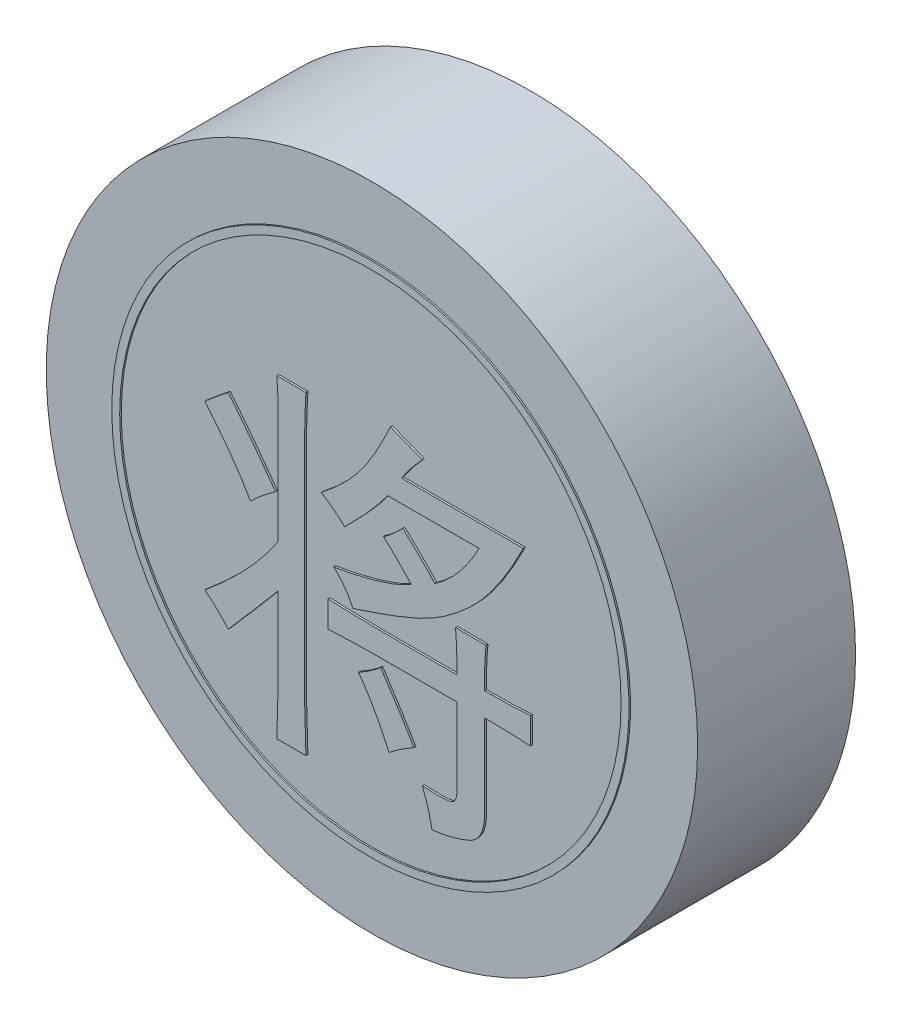
from build123d import *

# Parameters (mm, degrees)
SKETCH_1_R               = 16.5
DIAMETER33_HEIGHT8_DEPTH = 8
CHARACTER_DEPTH          = 0.1
SKETCH_3_R               = 13.1
SKETCH_3_R_2             = 12.7
INK_RING_DEPTH           = 0.08


with BuildPart() as part:
    # 草图1 → Diameter33_Height8 (new body)
    with BuildSketch(Plane.XY):
        Circle(SKETCH_1_R)
    extrude(amount=-DIAMETER33_HEIGHT8_DEPTH)

    # 草图2 → Character_将 (add)
    with BuildSketch(Plane.XY):
        with BuildLine():
            add(Edge.make_bspline(
                [(2.649122807, 5.675438596), (2.547995251, 5.560756708), (2.350386158, 5.336661664), (2.072088619, 4.999996886), (1.82216465, 4.669957417), (1.670222599, 4.449220176), (1.596491228, 4.342105263)],
                knots=[0, 0, 0, 0, 1.079161469, 2.108743928, 3.08224943, 4, 4, 4, 4], degree=3))
            Line((1.596491228, 4.342105263), (7.771929825, 4.342105263))
            add(Edge.make_bspline(
                [(7.771929825, 4.342105263), (7.667293114, 4.137951126), (7.462897396, 3.739159623), (7.14650433, 3.165780002), (6.830319772, 2.631431553), (6.509334526, 2.138740654), (6.187952882, 1.684181362), (5.866518034, 1.267837973), (5.544066977, 0.891001401), (5.114912302, 0.451463673), (4.575373631, -0.039323123), (3.911001462, -0.553369879), (3.238867264, -0.992218958), (2.540150828, -1.354562345), (1.794560835, -1.669402354), (0.986464371, -1.988789786), (0.091866991, -2.300206116), (-0.534313385, -2.500960186), (-0.859649123, -2.605263158)],
                knots=[0, 0, 0, 0, 0.956461889, 1.868337722, 2.730067817, 3.544633787, 4.319388845, 5.05060464, 5.737050918, 6.385914423, 7.610816521, 8.774810077, 9.884977967, 10.952971927, 12.051495524, 13.258260257, 14.57551281, 16, 16, 16, 16], degree=3))
            add(Edge.make_bspline(
                [(-0.859649123, -2.605263158), (-0.921076882, -2.479868395), (-1.043665257, -2.2296242), (-1.274908543, -1.88231672), (-1.537540367, -1.557773281), (-1.740146746, -1.367621007), (-1.842105263, -1.271929825)],
                knots=[0, 0, 0, 0, 1.00365356, 2.002942333, 2.995011704, 4, 4, 4, 4], degree=3))
            add(Edge.make_bspline(
                [(-1.842105263, -1.271929825), (-1.675538979, -1.246374258), (-1.334292248, -1.194018203), (-0.817047115, -1.088944947), (-0.281868941, -0.962437589), (0.26066697, -0.822709346), (0.785261702, -0.659231778), (1.270303533, -0.485149549), (1.701410748, -0.29397459), (1.963035545, -0.14834889), (2.087719298, -0.078947368)],
                knots=[0, 0, 0, 0, 0.979493574, 2.006702509, 3.067069232, 4.176257781, 5.262653342, 6.260045427, 7.170781712, 8, 8, 8, 8], degree=3))
            add(Edge.make_bspline(
                [(2.087719298, -0.078947368), (1.86881131, 0.157847942), (1.419350477, 0.644034938), (0.933453464, 1.093834703), (0.684210526, 1.324561404)],
                knots=[0, 0, 0, 0, 0.9740915, 2, 2, 2, 2], degree=3))
            add(Edge.make_bspline(
                [(0.684210526, 1.324561404), (0.710565367, 1.338712046), (0.768728724, 1.369941559), (0.8562959, 1.435673371), (0.960989273, 1.512375064), (1.077300152, 1.60862876), (1.20485704, 1.724784176), (1.346913264, 1.856517261), (1.503626832, 2.004770556), (1.610586189, 2.110979593), (1.666666667, 2.166666667)],
                knots=[0, 0, 0, 0, 0.552596433, 1.21954308, 2.020828341, 2.954454623, 4.009841916, 5.21187664, 6.538142936, 8, 8, 8, 8], degree=3))
            add(Edge.make_bspline(
                [(1.666666667, 2.166666667), (1.762088582, 2.076694304), (1.945781391, 1.903492207), (2.207761274, 1.652569932), (2.444121991, 1.419311081), (2.660802857, 1.21064161), (2.849941343, 1.018500147), (3.014552693, 0.845260055), (3.157352305, 0.694175397), (3.241984657, 0.59705955), (3.280701754, 0.552631579)],
                knots=[0, 0, 0, 0, 1.378471289, 2.653638435, 3.812716353, 4.868778462, 5.815322237, 6.646168057, 7.380657144, 8, 8, 8, 8], degree=3))
            add(Edge.make_bspline(
                [(3.280701754, 0.552631579), (3.391202618, 0.631480441), (3.613289383, 0.789952403), (3.925066626, 1.061581392), (4.227212607, 1.354774561), (4.515811142, 1.674868514), (4.790052671, 2.022264561), (5.04755707, 2.397774585), (5.300674154, 2.794713982), (5.450227675, 3.076125129), (5.526315789, 3.219298246)],
                knots=[0, 0, 0, 0, 0.924716273, 1.858512587, 2.814741213, 3.793048226, 4.793625974, 5.828834084, 6.895379252, 8, 8, 8, 8], degree=3))
            Line((5.526315789, 3.219298246), (0.894736842, 3.219298246))
            add(Edge.make_bspline(
                [(0.894736842, 3.219298246), (0.83815544, 3.13915603), (0.718899079, 2.970240651), (0.517872436, 2.712555071), (0.284245547, 2.438580125), (0.028819729, 2.1389746), (-0.257841465, 1.822404833), (-0.573265384, 1.487064304), (-0.916268812, 1.130854683), (-1.156498533, 0.888473475), (-1.280701754, 0.763157895)],
                knots=[0, 0, 0, 0, 0.716714086, 1.510614975, 2.386739176, 3.347269716, 4.387082353, 5.506647018, 6.710890262, 8, 8, 8, 8], degree=3))
            add(Edge.make_bspline(
                [(-1.280701754, 0.763157895), (-1.366268731, 0.844926758), (-1.540008164, 1.010954314), (-1.826521144, 1.242692633), (-2.138185293, 1.466482593), (-2.360232461, 1.604778386), (-2.473684211, 1.675438596)],
                knots=[0, 0, 0, 0, 0.943180642, 1.915080753, 2.934741037, 4, 4, 4, 4], degree=3))
            add(Edge.make_bspline(
                [(-2.473684211, 1.675438596), (-2.272414736, 1.836812452), (-1.882629089, 2.149334821), (-1.349168985, 2.642060255), (-0.878699224, 3.132161086), (-0.534402525, 3.552870114), (-0.285762925, 3.901948228), (-0.098629156, 4.179634678), (0.090025045, 4.479618404), (0.274039184, 4.80436189), (0.466182213, 5.147479353), (0.653863844, 5.514727625), (0.847964968, 5.901647032), (0.971732223, 6.169768333), (1.035087719, 6.307017544)],
                knots=[0, 0, 0, 0, 1.578922043, 3.057796785, 4.442105242, 5.735171578, 6.381329358, 7.06536331, 7.784990334, 8.550089925, 9.350129919, 10.192259238, 11.074631549, 12, 12, 12, 12], degree=3))
            add(Edge.make_bspline(
                [(1.035087719, 6.307017544), (1.125250521, 6.273390025), (1.299686952, 6.208331438), (1.550472821, 6.111824655), (1.782523727, 6.024473215), (1.993085056, 5.940034543), (2.184825827, 5.865357958), (2.357475637, 5.79753416), (2.510353639, 5.736054569), (2.605023832, 5.694701537), (2.649122807, 5.675438596)],
                knots=[0, 0, 0, 0, 1.33238246, 2.57773759, 3.720603536, 4.765328367, 5.71873806, 6.569669246, 7.333727776, 8, 8, 8, 8], degree=3))
        make_face()
        with BuildLine():
            Line((4.403508772, -2.885964912), (4.403508772, -2.254385965))
            add(Edge.make_bspline(
                [(4.403508772, -2.254385965), (4.40224465, -2.15474185), (4.399572645, -1.9441217), (4.385382124, -1.61054798), (4.365582936, -1.242167427), (4.344397253, -0.985117725), (4.333333333, -0.850877193)],
                knots=[0, 0, 0, 0, 0.85071404, 1.798174621, 2.850128174, 4, 4, 4, 4], degree=3))
            Line((4.333333333, -0.850877193), (5.877192982, -0.850877193))
            add(Edge.make_bspline(
                [(5.877192982, -0.850877193), (5.866199728, -0.972122237), (5.845563067, -1.199724799), (5.825418735, -1.520436791), (5.811312242, -1.796827769), (5.808358273, -1.966740639), (5.807017544, -2.043859649)],
                knots=[0, 0, 0, 0, 1.222087738, 2.294116862, 3.22574423, 4, 4, 4, 4], degree=3))
            Line((5.807017544, -2.043859649), (5.807017544, -2.885964912))
            Line((5.807017544, -2.885964912), (6.157894737, -2.885964912))
            add(Edge.make_bspline(
                [(6.157894737, -2.885964912), (6.330311021, -2.884831378), (6.669992765, -2.882598173), (7.169931961, -2.86903792), (7.652726223, -2.849819878), (7.9677758, -2.827012598), (8.122807018, -2.815789474)],
                knots=[0, 0, 0, 0, 1.0520594, 2.072689219, 3.051598987, 4, 4, 4, 4], degree=3))
            Line((8.122807018, -2.815789474), (8.122807018, -4.149122807))
            add(Edge.make_bspline(
                [(8.122807018, -4.149122807), (7.950439783, -4.137989416), (7.611925986, -4.116124435), (7.111871906, -4.096449339), (6.629272704, -4.082601006), (6.312983039, -4.080149454), (6.157894737, -4.078947368)],
                knots=[0, 0, 0, 0, 1.053977181, 2.069916693, 3.053610102, 4, 4, 4, 4], degree=3))
            Line((6.157894737, -4.078947368), (5.807017544, -4.078947368))
            Line((5.807017544, -4.078947368), (5.807017544, -8.289473684))
            add(Edge.make_bspline(
                [(5.807017544, -8.289473684), (5.804617944, -8.384908574), (5.800039465, -8.566999965), (5.763003431, -8.827475832), (5.704853654, -9.061790404), (5.621876352, -9.271155946), (5.511544303, -9.452685232), (5.377367913, -9.608351051), (5.218855699, -9.739017365), (4.968170287, -9.872303884), (4.617524481, -10.002095619), (4.165997239, -10.14171234), (3.668495948, -10.250361894), (3.320935844, -10.299190882), (3.140350877, -10.324561404)],
                knots=[0, 0, 0, 0, 0.904848947, 1.726467161, 2.489802636, 3.190213738, 3.853995735, 4.494848733, 5.13141999, 5.789890829, 7.176979744, 8.671668547, 10.270668525, 12, 12, 12, 12], degree=3))
            add(Edge.make_bspline(
                [(3.140350877, -10.324561404), (3.114315887, -10.183849573), (3.061895001, -9.90052937), (2.951534094, -9.478605317), (2.813479402, -9.057436755), (2.704227026, -8.780188232), (2.649122807, -8.640350877)],
                knots=[0, 0, 0, 0, 0.976532204, 1.966226292, 2.974214425, 4, 4, 4, 4], degree=3))
            add(Edge.make_bspline(
                [(2.649122807, -8.640350877), (2.760008996, -8.644813259), (2.967881434, -8.65317865), (3.260714513, -8.6630198), (3.515616254, -8.660335732), (3.732319603, -8.650151333), (3.91120767, -8.635662095), (4.052065285, -8.614811078), (4.155685995, -8.583483186), (4.244428293, -8.530146804), (4.310169464, -8.436952085), (4.364681951, -8.312867261), (4.399202709, -8.167354981), (4.402021496, -8.063545106), (4.403508772, -8.00877193)],
                knots=[0, 0, 0, 0, 1.84270246, 3.454416252, 4.864233575, 6.073954754, 7.055944869, 7.843457503, 8.43482508, 8.84195256, 9.538407401, 10.278927917, 11.091911197, 12, 12, 12, 12], degree=3))
            Line((4.403508772, -8.00877193), (4.403508772, -4.078947368))
            Line((4.403508772, -4.078947368), (0.473684211, -4.078947368))
            add(Edge.make_bspline(
                [(0.473684211, -4.078947368), (0.035223709, -4.082048212), (-0.830742979, -4.088172429), (-1.695766466, -4.128978076), (-2.122807018, -4.149122807)],
                knots=[0, 0, 0, 0, 1.012649812, 2, 2, 2, 2], degree=3))
            Line((-2.122807018, -4.149122807), (-2.122807018, -2.815789474))
            add(Edge.make_bspline(
                [(-2.122807018, -2.815789474), (-1.695766466, -2.835934205), (-0.830742979, -2.876739852), (0.035223709, -2.882864069), (0.473684211, -2.885964912)],
                knots=[0, 0, 0, 0, 0.987350188, 2, 2, 2, 2], degree=3))
            Line((0.473684211, -2.885964912), (4.403508772, -2.885964912))
        make_face()
        with BuildLine():
            add(Edge.make_bspline(
                [(-4.649122807, 3.850877193), (-4.650242479, 4.012031888), (-4.652440044, 4.328327841), (-4.666100186, 4.793612351), (-4.685130475, 5.240915624), (-4.708061813, 5.53254112), (-4.719298246, 5.675438596)],
                knots=[0, 0, 0, 0, 1.058831035, 2.078152119, 3.058288058, 4, 4, 4, 4], degree=3))
            Line((-4.719298246, 5.675438596), (-3.245614035, 5.675438596))
            add(Edge.make_bspline(
                [(-3.245614035, 5.675438596), (-3.256754045, 5.479675144), (-3.278681024, 5.09435221), (-3.298318206, 4.524139385), (-3.31215814, 3.97136857), (-3.314592679, 3.608303578), (-3.315789474, 3.429824561)],
                knots=[0, 0, 0, 0, 1.047124439, 2.061064296, 3.046839149, 4, 4, 4, 4], degree=3))
            Line((-3.315789474, 3.429824561), (-3.315789474, -7.728070175))
            add(Edge.make_bspline(
                [(-3.315789474, -7.728070175), (-3.316092605, -7.772259233), (-3.316811968, -7.877124688), (-3.309062957, -8.061588088), (-3.305703414, -8.298163643), (-3.297206883, -8.588384779), (-3.286094854, -8.929683722), (-3.277448581, -9.324850839), (-3.259865465, -9.771778148), (-3.250526384, -10.08803507), (-3.245614035, -10.254385965)],
                knots=[0, 0, 0, 0, 0.419579496, 0.995707933, 1.752775263, 2.666311164, 3.752780118, 4.995500302, 6.419635506, 8, 8, 8, 8], degree=3))
            Line((-3.245614035, -10.254385965), (-4.719298246, -10.254385965))
            add(Edge.make_bspline(
                [(-4.719298246, -10.254385965), (-4.714385897, -10.08803507), (-4.705046816, -9.771778148), (-4.6874637, -9.324850839), (-4.678817427, -8.929683722), (-4.667705397, -8.588384779), (-4.659208867, -8.298163643), (-4.655849323, -8.061588088), (-4.648100312, -7.877124688), (-4.648819676, -7.772259233), (-4.649122807, -7.728070175)],
                knots=[0, 0, 0, 0, 1.580364494, 3.004499698, 4.247219882, 5.333688836, 6.247224737, 7.004292067, 7.580420504, 8, 8, 8, 8], degree=3))
            Line((-4.649122807, -7.728070175), (-4.649122807, -3.728070175))
            add(Edge.make_bspline(
                [(-4.649122807, -3.728070175), (-4.769568631, -3.871002124), (-5.006100052, -4.151691781), (-5.35356813, -4.564765665), (-5.68894934, -4.95974818), (-6.011044255, -5.336786754), (-6.321223268, -5.695565274), (-6.616642122, -6.038538785), (-6.899900808, -6.363471833), (-7.085229085, -6.573302445), (-7.175438596, -6.675438596)],
                knots=[0, 0, 0, 0, 1.155566342, 2.269300341, 3.337112721, 4.359017331, 5.335029974, 6.269215869, 7.157531738, 8, 8, 8, 8], degree=3))
            add(Edge.make_bspline(
                [(-7.175438596, -6.675438596), (-7.287276066, -6.555121596), (-7.498805657, -6.327553804), (-7.80833224, -6.018845957), (-8.092563746, -5.761962778), (-8.28086151, -5.619075148), (-8.368421053, -5.552631579)],
                knots=[0, 0, 0, 0, 1.201217936, 2.271985754, 3.196463447, 4, 4, 4, 4], degree=3))
            add(Edge.make_bspline(
                [(-8.368421053, -5.552631579), (-8.163675327, -5.379811495), (-7.763006933, -5.041618621), (-7.194884126, -4.523507307), (-6.665328954, -4.014663769), (-6.179744484, -3.510252165), (-5.733901533, -3.015083659), (-5.332890918, -2.524074368), (-4.968604248, -2.042479693), (-4.753900542, -1.713283089), (-4.649122807, -1.552631579)],
                knots=[0, 0, 0, 0, 1.172627158, 2.294722579, 3.364754358, 4.386529231, 5.358665931, 6.280215446, 7.160726502, 8, 8, 8, 8], degree=3))
            Line((-4.649122807, -1.552631579), (-4.649122807, 3.850877193))
        make_face()
        with BuildLine():
            add(Edge.make_bspline(
                [(-7.175438596, 3.710526316), (-6.949470213, 3.426055069), (-6.511385068, 2.87455036), (-5.886577545, 2.064045419), (-5.317733876, 1.295331793), (-4.961154243, 0.79400352), (-4.789473684, 0.552631579)],
                knots=[0, 0, 0, 0, 1.101296642, 2.13508497, 3.102108969, 4, 4, 4, 4], degree=3))
            add(Edge.make_bspline(
                [(-4.789473684, 0.552631579), (-4.904851921, 0.47079712), (-5.13283793, 0.309093213), (-5.454330988, 0.045185684), (-5.764772162, -0.218787075), (-5.957484743, -0.407050044), (-6.052631579, -0.5)],
                knots=[0, 0, 0, 0, 1.030766017, 2.036781269, 3.030711695, 4, 4, 4, 4], degree=3))
            add(Edge.make_bspline(
                [(-6.052631579, -0.5), (-6.120204141, -0.379932032), (-6.258767697, -0.133721971), (-6.489714365, 0.23658721), (-6.74460987, 0.619245955), (-7.01898538, 1.018234835), (-7.322641791, 1.426687506), (-7.649854841, 1.848416606), (-7.997626051, 2.286997817), (-8.242928332, 2.578792623), (-8.368421053, 2.728070175)],
                knots=[0, 0, 0, 0, 0.830940233, 1.703916959, 2.6314913, 3.604145779, 4.624214172, 5.700807236, 6.823769784, 8, 8, 8, 8], degree=3))
            add(Edge.make_bspline(
                [(-8.368421053, 2.728070175), (-8.17632244, 2.893148468), (-7.785531234, 3.228971535), (-7.381077646, 3.548212494), (-7.175438596, 3.710526316)],
                knots=[0, 0, 0, 0, 0.98312659, 2, 2, 2, 2], degree=3))
        make_face()
        with BuildLine():
            add(Edge.make_bspline(
                [(0.543859649, -4.5), (0.639987888, -4.64730524), (0.824761144, -4.930448558), (1.092103478, -5.33880977), (1.331508976, -5.719995519), (1.558016339, -6.065613817), (1.752208101, -6.387297693), (1.934249012, -6.672170946), (2.089575344, -6.929049009), (2.184074382, -7.091182425), (2.228070175, -7.166666667)],
                knots=[0, 0, 0, 0, 1.338333826, 2.572483377, 3.7135535, 4.763123252, 5.716205277, 6.572152244, 7.33523879, 8, 8, 8, 8], degree=3))
            add(Edge.make_bspline(
                [(2.228070175, -7.166666667), (2.014893834, -7.290904276), (1.57691346, -7.546156027), (1.172491595, -7.851861298), (0.964912281, -8.00877193)],
                knots=[0, 0, 0, 0, 0.973451572, 2, 2, 2, 2], degree=3))
            add(Edge.make_bspline(
                [(0.964912281, -8.00877193), (0.85679125, -7.766584267), (0.641210895, -7.283691144), (0.269907843, -6.586463991), (-0.131220406, -5.911863932), (-0.429849414, -5.485034852), (-0.578947368, -5.271929825)],
                knots=[0, 0, 0, 0, 1.010640663, 2.01509614, 3.008987412, 4, 4, 4, 4], degree=3))
            add(Edge.make_bspline(
                [(-0.578947368, -5.271929825), (-0.476099585, -5.213174383), (-0.272663583, -5.096954357), (0.016998287, -4.907628062), (0.289138196, -4.709430299), (0.459606879, -4.569272072), (0.543859649, -4.5)],
                knots=[0, 0, 0, 0, 1.041332516, 2.059786956, 3.041065375, 4, 4, 4, 4], degree=3))
        make_face()
    extrude(amount=CHARACTER_DEPTH)

    # 草图3 → Ink_ring (add)
    with BuildSketch(Plane.XY):
        with Locations(Location((0, 0, 0), (0, 0, 180))):
            Circle(SKETCH_3_R)
        with Locations(Location((0, 0, 0), (0, 0, 180))):
            Circle(SKETCH_3_R_2, mode=Mode.SUBTRACT)
    extrude(amount=INK_RING_DEPTH)


solid = part.part
